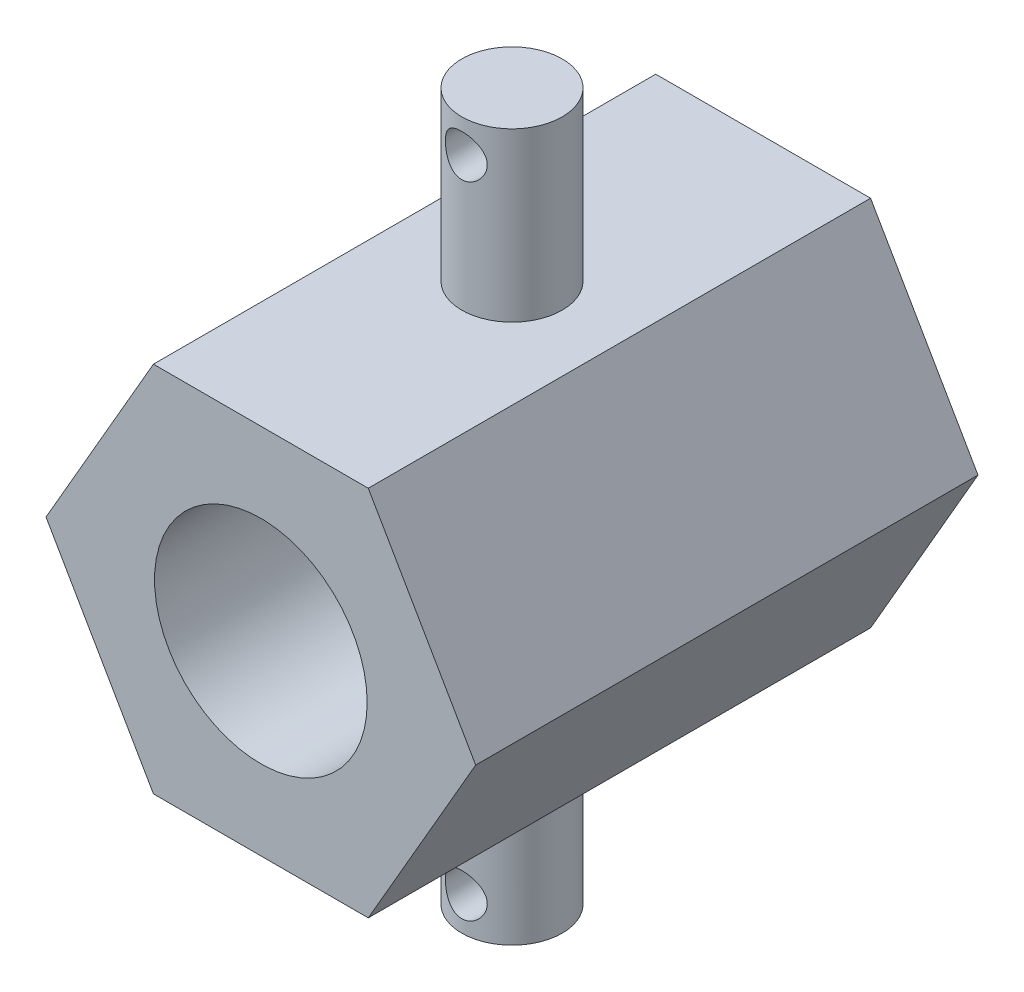
from build123d import *

# Parameters (mm, degrees)
SKETCH1_R           = 6.35
BOSS_EXTRUDE1_DEPTH = 30
SKETCH2_R           = 3
BOSS_EXTRUDE2_DEPTH = 10
SKETCH3_R           = 1.25
CUT_EXTRUDE1_DEPTH  = 39.863708837


with BuildPart() as part:
    # Sketch1 → Boss-Extrude1 (new body)
    with BuildSketch(Plane.XY):
        Polygon((6.415804866, -11.1125), (12.831609733, 0), (6.415804866, 11.1125), (-6.415804866, 11.1125), (-12.831609733, 0), (-6.415804866, -11.1125), align=None)
        Circle(SKETCH1_R, mode=Mode.SUBTRACT)
    extrude(amount=BOSS_EXTRUDE1_DEPTH)

    # Sketch2 → Boss-Extrude2 (add)
    with BuildSketch(Plane.XZ.offset(11.1125)):
        with Locations(Location((0, 15, 0), (0, 0, 180))):
            Circle(SKETCH2_R)
    boss_extrude2 = extrude(amount=BOSS_EXTRUDE2_DEPTH)

    # Sketch3 → Cut-Extrude1 (cut, through all)
    with BuildSketch(Plane.XY):
        with Locations(Location((0, -19.1125, 0), (0, 0, 180))):
            Circle(SKETCH3_R)
    cut_extrude1 = extrude(amount=CUT_EXTRUDE1_DEPTH, mode=Mode.SUBTRACT)

    # Mirror1: Boss-Extrude2, Cut-Extrude1 across plane
    add(boss_extrude2.mirror(Plane.ZX))
    add(cut_extrude1.mirror(Plane.ZX), mode=Mode.SUBTRACT)


solid = part.part
